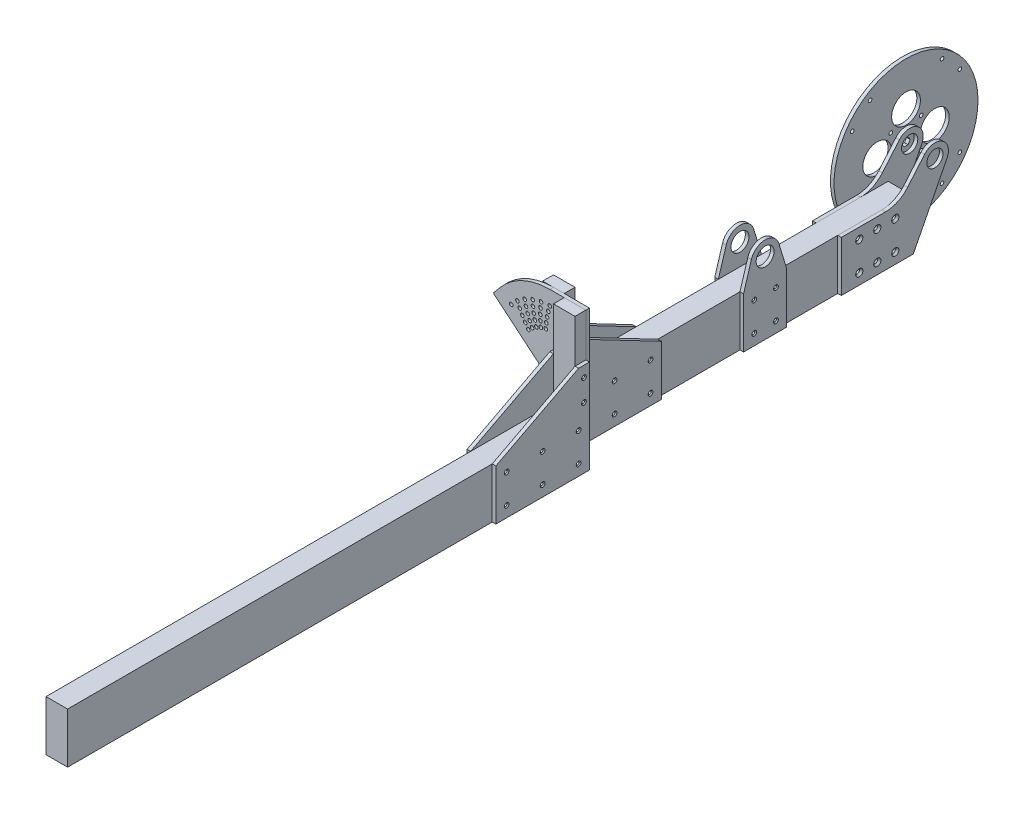
from build123d import *

# Parameters (mm, degrees)
SKETCH1_R                                   = 127
SKETCH1_R_2                                 = 25.4
BOSS_EXTRUDE1_DEPTH                         = 6.35
SKETCH3_R                                   = 3.175
CUT_EXTRUDE1_DEPTH                          = 6.35
SKETCH4_R                                   = 14.2875
BOSS_EXTRUDE2_DEPTH                         = 6.35
SKETCH5_R                                   = 3.175
CUT_EXTRUDE2_DEPTH                          = 6.35
CHAMFER1_SIZE                               = 3.175
SKETCH7_W                                   = 38.1
SKETCH7_H                                   = 88.9
BOSS_EXTRUDE3_DEPTH                         = 609.6
SKETCH8_W                                   = 38.1
SKETCH8_H                                   = 19.05
BOSS_EXTRUDE4_DEPTH                         = 152.4
BOSS_EXTRUDE5_DEPTH                         = 6.35
CSK_FOR_8_FLAT_HEAD_MACHINE_SCREW_2_COUNT   = 2
CSK_FOR_8_FLAT_HEAD_MACHINE_SCREW_2_PITCH   = 38.1
CSK_FOR_8_FLAT_HEAD_MACHINE_SCREW_3_COUNT   = 2
CSK_FOR_8_FLAT_HEAD_MACHINE_SCREW_3_PITCH   = 76.793005053
CSK_FOR_8_FLAT_HEAD_MACHINE_SCREW_4_COUNT   = 2
CSK_FOR_8_FLAT_HEAD_MACHINE_SCREW_4_PITCH   = 127.356686613
CSK_FOR_8_FLAT_HEAD_MACHINE_SCREW_5_COUNT   = 2
CSK_FOR_8_FLAT_HEAD_MACHINE_SCREW_5_PITCH   = 146.497954337
CSK_FOR_8_FLAT_HEAD_MACHINE_SCREW_6_COUNT   = 2
CSK_FOR_8_FLAT_HEAD_MACHINE_SCREW_6_PITCH   = 105.54189038
CSK_FOR_8_FLAT_HEAD_MACHINE_SCREW_7_COUNT   = 2
CSK_FOR_8_FLAT_HEAD_MACHINE_SCREW_7_PITCH   = 156.350617604
CSK_FOR_8_FLAT_HEAD_MACHINE_SCREW_8_COUNT   = 2
CSK_FOR_8_FLAT_HEAD_MACHINE_SCREW_8_PITCH   = 186.461995122
SKETCH13_R                                  = 3.175
CUT_EXTRUDE3_DEPTH                          = 19.05
SKETCH16_R                                  = 3.175
CUT_EXTRUDE5_DEPTH                          = 19.05
SKETCH14_R                                  = 3.175
BOSS_EXTRUDE6_DEPTH                         = 6.35
CSK_FOR_8_FLAT_HEAD_MACHINE_SCREW_9_A_COUNT = 2
CSK_FOR_8_FLAT_HEAD_MACHINE_SCREW_9_A_PITCH = 101.6
CSK_FOR_8_FLAT_HEAD_MACHINE_SCREW_10_COUNT  = 2
CSK_FOR_8_FLAT_HEAD_MACHINE_SCREW_10_PITCH  = 76.2
CSK_FOR_8_FLAT_HEAD_MACHINE_SCREW_11_COUNT  = 2
CSK_FOR_8_FLAT_HEAD_MACHINE_SCREW_11_PITCH  = 50.8
CSK_FOR_8_FLAT_HEAD_MACHINE_SCREW_12_COUNT  = 2
CSK_FOR_8_FLAT_HEAD_MACHINE_SCREW_12_PITCH  = 25.4
SKETCH21_W                                  = 38.1
SKETCH21_H                                  = 152.4
BOSS_EXTRUDE7_DEPTH                         = 19.05
SKETCH24_R                                  = 15.875
BOSS_EXTRUDE11_DEPTH                        = 6.35
CSK_FOR_8_FLAT_HEAD_MACHINE_SCREW_14_COUNT  = 2
CSK_FOR_8_FLAT_HEAD_MACHINE_SCREW_14_PITCH  = 50.8
CSK_FOR_8_FLAT_HEAD_MACHINE_SCREW_15_COUNT  = 2
CSK_FOR_8_FLAT_HEAD_MACHINE_SCREW_15_PITCH  = 63.5
CSK_FOR_8_FLAT_HEAD_MACHINE_SCREW_16_COUNT  = 2
CSK_FOR_8_FLAT_HEAD_MACHINE_SCREW_16_PITCH  = 38.1
BOSS_EXTRUDE12_DEPTH                        = 6.35
CSK_FOR_8_FLAT_HEAD_MACHINE_SCREW_18_COUNT  = 2
CSK_FOR_8_FLAT_HEAD_MACHINE_SCREW_18_PITCH  = 38.1
CSK_FOR_8_FLAT_HEAD_MACHINE_SCREW_19_COUNT  = 2
CSK_FOR_8_FLAT_HEAD_MACHINE_SCREW_19_PITCH  = 76.793005053
CSK_FOR_8_FLAT_HEAD_MACHINE_SCREW_20_COUNT  = 2
CSK_FOR_8_FLAT_HEAD_MACHINE_SCREW_20_PITCH  = 127.356686613
CSK_FOR_8_FLAT_HEAD_MACHINE_SCREW_21_COUNT  = 2
CSK_FOR_8_FLAT_HEAD_MACHINE_SCREW_21_PITCH  = 105.54189038
CSK_FOR_8_FLAT_HEAD_MACHINE_SCREW_22_COUNT  = 2
CSK_FOR_8_FLAT_HEAD_MACHINE_SCREW_22_PITCH  = 146.497954337
CSK_FOR_8_FLAT_HEAD_MACHINE_SCREW_23_COUNT  = 2
CSK_FOR_8_FLAT_HEAD_MACHINE_SCREW_23_PITCH  = 156.350617604
CSK_FOR_8_FLAT_HEAD_MACHINE_SCREW_24_COUNT  = 2
CSK_FOR_8_FLAT_HEAD_MACHINE_SCREW_24_PITCH  = 186.461995122
SKETCH33_W                                  = 38.1
SKETCH33_H                                  = 88.9
BOSS_EXTRUDE13_DEPTH                        = 914.4


with BuildPart() as part:
    # Sketch1 → Boss-Extrude1 (new body)
    with BuildSketch(Plane(origin=(0, 0, 0), x_dir=(0, 0, -1), z_dir=(1, 0, 0))):
        Circle(SKETCH1_R)
        with Locations((0, 50.8)):
            Circle(SKETCH1_R_2, mode=Mode.SUBTRACT)
        with Locations((50.8, 0)):
            Circle(SKETCH1_R_2, mode=Mode.SUBTRACT)
        with Locations((0, -50.8)):
            Circle(SKETCH1_R_2, mode=Mode.SUBTRACT)
        with Locations((-50.8, 0)):
            Circle(SKETCH1_R_2, mode=Mode.SUBTRACT)
        Polygon((7.18570145, 0), (3.592850725, 6.223), (-3.592850725, 6.223), (-7.18570145, 0), (-3.592850725, -6.223), (3.592850725, -6.223), align=None, mode=Mode.SUBTRACT)
    extrude(amount=BOSS_EXTRUDE1_DEPTH)

    # Sketch3 → Cut-Extrude1 (cut)
    with BuildSketch(Plane(origin=(6.35, 0, 0), x_dir=(0, 0, -1), z_dir=(1, 0, 0))):
        with Locations((-26.940768363, 26.940768363)):
            Circle(SKETCH3_R)
        with Locations((26.940768363, 26.940768363)):
            Circle(SKETCH3_R)
        with Locations((26.940768363, -26.940768363)):
            Circle(SKETCH3_R)
        with Locations((-26.940768363, -26.940768363)):
            Circle(SKETCH3_R)
        with Locations((-63.5, 95.038097624)):
            Circle(SKETCH3_R)
        with Locations((63.5, 95.038097624)):
            Circle(SKETCH3_R)
        with Locations((95.038097624, 63.5)):
            Circle(SKETCH3_R)
        with Locations((95.038097624, -63.5)):
            Circle(SKETCH3_R)
        with Locations((63.5, -95.038097624)):
            Circle(SKETCH3_R)
        with Locations((-63.5, -95.038097624)):
            Circle(SKETCH3_R)
        with Locations((-95.038097624, -63.5)):
            Circle(SKETCH3_R)
        with Locations((-95.038097624, 63.5)):
            Circle(SKETCH3_R)
    extrude(amount=-CUT_EXTRUDE1_DEPTH, mode=Mode.SUBTRACT)


with BuildPart() as body_2:
    # Sketch4 → Boss-Extrude2 (new body)
    with BuildSketch(Plane(origin=(6.477, 0, 0), x_dir=(0, 0, -1), z_dir=(1, 0, 0))):
        with BuildLine():
            Line((-38.1, -127), (-165.1, -127))
            Line((-165.1, -127), (-165.1, -38.1))
            Line((-165.1, -38.1), (-87.038042562, -38.1))
            ThreePointArc((-87.038042562, -38.1), (-65.681178278, -33.392562827), (-48.282428043, -20.142690865))
            Line((-48.282428043, -20.142690865), (-18.166694306, 15.395011343))
            ThreePointArc((-18.166694306, 15.395011343), (13.199129751, 19.819640008), (21.208545562, -10.827407419))
            Line((21.208545562, -10.827407419), (-38.1, -127))
        make_face()
        Circle(SKETCH4_R, mode=Mode.SUBTRACT)
    extrude(amount=BOSS_EXTRUDE2_DEPTH)

    # Sketch5 → Cut-Extrude2 (cut)
    with BuildSketch(Plane(origin=(12.827, 0, 0), x_dir=(0, 0, -1), z_dir=(1, 0, 0))):
        with Locations((-133.35, -57.15)):
            Circle(SKETCH5_R)
        with Locations((-101.6, -57.15)):
            Circle(SKETCH5_R)
        with Locations((-69.85, -57.15)):
            Circle(SKETCH5_R)
        with Locations((-133.35, -107.95)):
            Circle(SKETCH5_R)
        with Locations((-101.6, -107.95)):
            Circle(SKETCH5_R)
        with Locations((-69.85, -107.95)):
            Circle(SKETCH5_R)
    extrude(amount=-CUT_EXTRUDE2_DEPTH, mode=Mode.SUBTRACT)

    # Chamfer1
    chamfer1_edges = [body_2.edges().sort_by_distance(p)[0] for p in [
        (6.477, -57.15, 104.775),
        (6.477, -57.15, 73.025),
        (6.477, -107.95, 136.525),
        (6.477, -107.95, 104.775),
        (6.477, -107.95, 73.025),
        (6.477, -57.15, 136.525),
    ]]
    chamfer(chamfer1_edges, length=CHAMFER1_SIZE)


with BuildPart() as body_3:
    # Sketch7 → Boss-Extrude3 (new body)
    with BuildSketch(Plane.XY.offset(38.1)):
        with Locations((31.877, -82.55)):
            Rectangle(SKETCH7_W, SKETCH7_H)
    extrude(amount=BOSS_EXTRUDE3_DEPTH)


with BuildPart() as body_4:
    # Mirror1: mirrored copy
    add(body_2.part.mirror(Plane(origin=(31.877, 0, 0), x_dir=(0, 0, 1), z_dir=(1, 0, 0))))


with BuildPart() as body_5:
    # Sketch8 → Boss-Extrude4 (new body)
    with BuildSketch(Plane(origin=(0, -38.1, 0), x_dir=(1, 0, 0), z_dir=(0, 1, 0))):
        with Locations((31.877, -638.175)):
            Rectangle(SKETCH8_W, SKETCH8_H)
    extrude(amount=BOSS_EXTRUDE4_DEPTH)


with BuildPart() as body_6:
    # Sketch9 → Boss-Extrude5 (new body)
    with BuildSketch(Plane.ZY.offset(-12.827)):
        Polygon((647.7, 38.1), (647.7, -127), (482.6, -127), (482.6, -38.1), (628.65, 38.1), align=None)
    extrude(amount=BOSS_EXTRUDE5_DEPTH)


with BuildPart() as csk_for_8_flat_head_machine_screw_100_tool:
    # Sketch11 → CSK for _8 Flat Head Machine Screw _100 (revolve)
    with BuildSketch(Plane(origin=(6.477, 19.05, 638.175), x_dir=(0, 0, 1), z_dir=(0, 1, 0))):
        Polygon((0, 0), (0, 8.945274586), (2.2479, 7.5946), (2.2479, 1.651767624), (4.2164, 0), align=None)
    csk_for_8_flat_head_machine_screw_100 = revolve(axis=Axis((0.127, 19.05, 638.175), (1, 0, 0)))


with BuildPart() as body_5_1:
    add(body_5.part)

    # CSK for _8 Flat Head Machine Screw _100: cut by csk_for_8_flat_head_machine_screw_100_tool
    add(csk_for_8_flat_head_machine_screw_100_tool.part, mode=Mode.SUBTRACT)


with BuildPart() as body_6_1:
    add(body_6.part)

    # CSK for _8 Flat Head Machine Screw _100: cut by csk_for_8_flat_head_machine_screw_100_tool
    add(csk_for_8_flat_head_machine_screw_100_tool.part, mode=Mode.SUBTRACT)


with BuildPart() as csk_for_8_flat_head_machine_screw_2_tool:
    # CSK for _8 Flat Head Machine Screw _ 2: CSK for _8 Flat Head Machine Screw _100 ×2
    with Locations(*[(0, -i * CSK_FOR_8_FLAT_HEAD_MACHINE_SCREW_2_PITCH, 0) for i in range(1, CSK_FOR_8_FLAT_HEAD_MACHINE_SCREW_2_COUNT)]):
        add(csk_for_8_flat_head_machine_screw_100)


with BuildPart() as body_5_2:
    add(body_5_1.part)

    # CSK for _8 Flat Head Machine Screw _ 2: cut by csk_for_8_flat_head_machine_screw_2_tool
    add(csk_for_8_flat_head_machine_screw_2_tool.part, mode=Mode.SUBTRACT)

    # Sketch13 → Cut-Extrude3 (cut)
    with BuildSketch(Plane.XY.offset(647.7)):
        with Locations((31.877, 0)):
            Circle(SKETCH13_R)
        with Locations((31.877, 88.9)):
            Circle(SKETCH13_R)
    extrude(amount=-CUT_EXTRUDE3_DEPTH, mode=Mode.SUBTRACT)

    # Sketch16 → Cut-Extrude5 (cut)
    with BuildSketch(Plane.XY.offset(647.7)):
        with Locations((31.877, 79.375)):
            Circle(SKETCH16_R)
        with Locations((31.877, 69.85)):
            Circle(SKETCH16_R)
        with Locations((31.877, 60.325)):
            Circle(SKETCH16_R)
        with Locations((31.877, 50.8)):
            Circle(SKETCH16_R)
    extrude(amount=-CUT_EXTRUDE5_DEPTH, mode=Mode.SUBTRACT)


with BuildPart() as body_6_2:
    add(body_6_1.part)

    # CSK for _8 Flat Head Machine Screw _ 2: cut by csk_for_8_flat_head_machine_screw_2_tool
    add(csk_for_8_flat_head_machine_screw_2_tool.part, mode=Mode.SUBTRACT)


with BuildPart() as csk_for_8_flat_head_machine_screw_3_tool:
    # CSK for _8 Flat Head Machine Screw _ 3: CSK for _8 Flat Head Machine Screw _100 ×2
    with Locations(*[Vector(0, -0.9922778767136677, -0.12403473458920822) * (i * CSK_FOR_8_FLAT_HEAD_MACHINE_SCREW_3_PITCH) for i in range(1, CSK_FOR_8_FLAT_HEAD_MACHINE_SCREW_3_COUNT)]):
        add(csk_for_8_flat_head_machine_screw_100)


with BuildPart() as body_3_1:
    add(body_3.part)

    # CSK for _8 Flat Head Machine Screw _ 3: cut by csk_for_8_flat_head_machine_screw_3_tool
    add(csk_for_8_flat_head_machine_screw_3_tool.part, mode=Mode.SUBTRACT)


with BuildPart() as body_6_3:
    add(body_6_2.part)

    # CSK for _8 Flat Head Machine Screw _ 3: cut by csk_for_8_flat_head_machine_screw_3_tool
    add(csk_for_8_flat_head_machine_screw_3_tool.part, mode=Mode.SUBTRACT)


with BuildPart() as csk_for_8_flat_head_machine_screw_4_tool:
    # CSK for _8 Flat Head Machine Screw _ 4: CSK for _8 Flat Head Machine Screw _100 ×2
    with Locations(*[Vector(0, -0.9971993098884565, -0.07478994824163403) * (i * CSK_FOR_8_FLAT_HEAD_MACHINE_SCREW_4_PITCH) for i in range(1, CSK_FOR_8_FLAT_HEAD_MACHINE_SCREW_4_COUNT)]):
        add(csk_for_8_flat_head_machine_screw_100)


with BuildPart() as body_3_2:
    add(body_3_1.part)

    # CSK for _8 Flat Head Machine Screw _ 4: cut by csk_for_8_flat_head_machine_screw_4_tool
    add(csk_for_8_flat_head_machine_screw_4_tool.part, mode=Mode.SUBTRACT)


with BuildPart() as body_6_4:
    add(body_6_3.part)

    # CSK for _8 Flat Head Machine Screw _ 4: cut by csk_for_8_flat_head_machine_screw_4_tool
    add(csk_for_8_flat_head_machine_screw_4_tool.part, mode=Mode.SUBTRACT)


with BuildPart() as csk_for_8_flat_head_machine_screw_5_tool:
    # CSK for _8 Flat Head Machine Screw _ 5: CSK for _8 Flat Head Machine Screw _100 ×2
    with Locations(*[Vector(0, -0.8669063030575354, -0.4984711242580825) * (i * CSK_FOR_8_FLAT_HEAD_MACHINE_SCREW_5_PITCH) for i in range(1, CSK_FOR_8_FLAT_HEAD_MACHINE_SCREW_5_COUNT)]):
        add(csk_for_8_flat_head_machine_screw_100)


with BuildPart() as body_3_3:
    add(body_3_2.part)

    # CSK for _8 Flat Head Machine Screw _ 5: cut by csk_for_8_flat_head_machine_screw_5_tool
    add(csk_for_8_flat_head_machine_screw_5_tool.part, mode=Mode.SUBTRACT)


with BuildPart() as body_6_5:
    add(body_6_4.part)

    # CSK for _8 Flat Head Machine Screw _ 5: cut by csk_for_8_flat_head_machine_screw_5_tool
    add(csk_for_8_flat_head_machine_screw_5_tool.part, mode=Mode.SUBTRACT)


with BuildPart() as csk_for_8_flat_head_machine_screw_6_tool:
    # CSK for _8 Flat Head Machine Screw _ 6: CSK for _8 Flat Head Machine Screw _100 ×2
    with Locations(*[Vector(0, -0.7219882051154243, -0.6919053632356149) * (i * CSK_FOR_8_FLAT_HEAD_MACHINE_SCREW_6_PITCH) for i in range(1, CSK_FOR_8_FLAT_HEAD_MACHINE_SCREW_6_COUNT)]):
        add(csk_for_8_flat_head_machine_screw_100)


with BuildPart() as body_3_4:
    add(body_3_3.part)

    # CSK for _8 Flat Head Machine Screw _ 6: cut by csk_for_8_flat_head_machine_screw_6_tool
    add(csk_for_8_flat_head_machine_screw_6_tool.part, mode=Mode.SUBTRACT)


with BuildPart() as body_6_6:
    add(body_6_5.part)

    # CSK for _8 Flat Head Machine Screw _ 6: cut by csk_for_8_flat_head_machine_screw_6_tool
    add(csk_for_8_flat_head_machine_screw_6_tool.part, mode=Mode.SUBTRACT)


with BuildPart() as csk_for_8_flat_head_machine_screw_7_tool:
    # CSK for _8 Flat Head Machine Screw _ 7: CSK for _8 Flat Head Machine Screw _100 ×2
    with Locations(*[Vector(0, -0.4873661592641371, -0.8731977020149125) * (i * CSK_FOR_8_FLAT_HEAD_MACHINE_SCREW_7_PITCH) for i in range(1, CSK_FOR_8_FLAT_HEAD_MACHINE_SCREW_7_COUNT)]):
        add(csk_for_8_flat_head_machine_screw_100)


with BuildPart() as body_3_5:
    add(body_3_4.part)

    # CSK for _8 Flat Head Machine Screw _ 7: cut by csk_for_8_flat_head_machine_screw_7_tool
    add(csk_for_8_flat_head_machine_screw_7_tool.part, mode=Mode.SUBTRACT)


with BuildPart() as body_6_7:
    add(body_6_6.part)

    # CSK for _8 Flat Head Machine Screw _ 7: cut by csk_for_8_flat_head_machine_screw_7_tool
    add(csk_for_8_flat_head_machine_screw_7_tool.part, mode=Mode.SUBTRACT)


with BuildPart() as csk_for_8_flat_head_machine_screw_8_tool:
    # CSK for _8 Flat Head Machine Screw _ 8: CSK for _8 Flat Head Machine Screw _100 ×2
    with Locations(*[Vector(0, -0.6811039424772873, -0.7321867381630838) * (i * CSK_FOR_8_FLAT_HEAD_MACHINE_SCREW_8_PITCH) for i in range(1, CSK_FOR_8_FLAT_HEAD_MACHINE_SCREW_8_COUNT)]):
        add(csk_for_8_flat_head_machine_screw_100)


with BuildPart() as body_3_6:
    add(body_3_5.part)

    # CSK for _8 Flat Head Machine Screw _ 8: cut by csk_for_8_flat_head_machine_screw_8_tool
    add(csk_for_8_flat_head_machine_screw_8_tool.part, mode=Mode.SUBTRACT)


with BuildPart() as body_6_8:
    add(body_6_7.part)

    # CSK for _8 Flat Head Machine Screw _ 8: cut by csk_for_8_flat_head_machine_screw_8_tool
    add(csk_for_8_flat_head_machine_screw_8_tool.part, mode=Mode.SUBTRACT)


with BuildPart() as body_7:
    # Mirror2: mirrored copy
    add(body_6_8.part.mirror(Plane(origin=(31.877, 0, 0), x_dir=(0, 0, 1), z_dir=(1, 0, 0))))


with BuildPart() as body_8:
    # Sketch14 → Boss-Extrude6 (new body)
    with BuildSketch(Plane.XY.offset(647.7)):
        with BuildLine():
            Line((57.277, -38.1), (12.827, -38.1))
            Line((12.827, -38.1), (12.827, -8.883160888))
            Line((12.827, -8.883160888), (-67.926983813, 58.877477146))
            Line((-67.926983813, 58.877477146), (-55.681879848, 73.470623787))
            ThreePointArc((-55.681879848, 73.470623787), (-16.428267317, 103.590980058), (31.877, 114.3))
            Line((31.877, 114.3), (50.927, 114.3))
            Line((50.927, 114.3), (95.377, 114.3))
            Line((95.377, 114.3), (95.377, -38.1))
            Line((95.377, -38.1), (57.277, -38.1))
        make_face()
        with Locations((31.877, 88.9)):
            Circle(SKETCH14_R, mode=Mode.SUBTRACT)
        with Locations((29.106852449, 79.326646895)):
            Circle(SKETCH14_R, mode=Mode.SUBTRACT)
        with Locations((15.374009541, 77.640465808)):
            Circle(SKETCH14_R, mode=Mode.SUBTRACT)
        with Locations((2.142601648, 73.595218456)):
            Circle(SKETCH14_R, mode=Mode.SUBTRACT)
        with Locations((-10.185341599, 67.313817632)):
            Circle(SKETCH14_R, mode=Mode.SUBTRACT)
        with Locations((-21.23524188, 58.987120522)):
            Circle(SKETCH14_R, mode=Mode.SUBTRACT)
        with Locations((27.004510309, 69.679848911)):
            Circle(SKETCH14_R, mode=Mode.SUBTRACT)
        with Locations((25.571320453, 59.994533338)):
            Circle(SKETCH14_R, mode=Mode.SUBTRACT)
        with Locations((24.807006471, 50.305617892)):
            Circle(SKETCH14_R, mode=Mode.SUBTRACT)
        with Locations((14.978755592, 67.77515648)):
            Circle(SKETCH14_R, mode=Mode.SUBTRACT)
        with Locations((3.466445481, 63.811150216)):
            Circle(SKETCH14_R, mode=Mode.SUBTRACT)
        with Locations((-7.182624307, 57.908274443)):
            Circle(SKETCH14_R, mode=Mode.SUBTRACT)
        with Locations((-16.644887177, 50.245885054)):
            Circle(SKETCH14_R, mode=Mode.SUBTRACT)
        with Locations((15.24917651, 57.988111807)):
            Circle(SKETCH14_R, mode=Mode.SUBTRACT)
        with Locations((5.43226057, 54.219750843)):
            Circle(SKETCH14_R, mode=Mode.SUBTRACT)
        with Locations((-3.581145345, 48.803950186)):
            Circle(SKETCH14_R, mode=Mode.SUBTRACT)
        with Locations((-11.517173455, 41.905266198)):
            Circle(SKETCH14_R, mode=Mode.SUBTRACT)
        with Locations((16.178936686, 48.313671028)):
            Circle(SKETCH14_R, mode=Mode.SUBTRACT)
        with Locations((8.02784461, 44.853737717)):
            Circle(SKETCH14_R, mode=Mode.SUBTRACT)
        with Locations((0.601397053, 40.030946283)):
            Circle(SKETCH14_R, mode=Mode.SUBTRACT)
        with Locations((-5.874757134, 33.991834803)):
            Circle(SKETCH14_R, mode=Mode.SUBTRACT)
        with Locations((16.439677005, 87.549409243)):
            Circle(SKETCH14_R, mode=Mode.SUBTRACT)
        with Locations((1.471409258, 83.538673988)):
            Circle(SKETCH14_R, mode=Mode.SUBTRACT)
        with Locations((-12.573, 76.989658396)):
            Circle(SKETCH14_R, mode=Mode.SUBTRACT)
        with Locations((-25.266818501, 68.101350993)):
            Circle(SKETCH14_R, mode=Mode.SUBTRACT)
        with Locations((-36.224350993, 57.143818501)):
            Circle(SKETCH14_R, mode=Mode.SUBTRACT)
        with Locations((31.877, 0)):
            Circle(SKETCH14_R, mode=Mode.SUBTRACT)
    extrude(amount=BOSS_EXTRUDE6_DEPTH)

    # Sketch20 → CSK for _8 Flat Head Machine Screw _ 9 (revolve, cut)
    with BuildSketch(Plane(origin=(76.327, 88.9, 647.7), x_dir=(0, 1, 0), z_dir=(1, 0, 0))):
        Polygon((0, 0), (0, 7.700674586), (2.2479, 6.35), (2.2479, 1.651767624), (4.2164, 0), align=None)
    csk_for_8_flat_head_machine_screw_9 = revolve(axis=Axis((76.327, 88.9, 641.35), (0, 0, 1)), mode=Mode.SUBTRACT)

    # CSK for _8 Flat Head Machine Screw _ 9 a: CSK for _8 Flat Head Machine Screw _ 9 ×2
    with Locations(*[(0, -i * CSK_FOR_8_FLAT_HEAD_MACHINE_SCREW_9_A_PITCH, 0) for i in range(1, CSK_FOR_8_FLAT_HEAD_MACHINE_SCREW_9_A_COUNT)]):
        add(csk_for_8_flat_head_machine_screw_9, mode=Mode.SUBTRACT)

    # CSK for _8 Flat Head Machine Screw _ 10: CSK for _8 Flat Head Machine Screw _ 9 ×2
    with Locations(*[(0, -i * CSK_FOR_8_FLAT_HEAD_MACHINE_SCREW_10_PITCH, 0) for i in range(1, CSK_FOR_8_FLAT_HEAD_MACHINE_SCREW_10_COUNT)]):
        add(csk_for_8_flat_head_machine_screw_9, mode=Mode.SUBTRACT)

    # CSK for _8 Flat Head Machine Screw _ 11: CSK for _8 Flat Head Machine Screw _ 9 ×2
    with Locations(*[(0, -i * CSK_FOR_8_FLAT_HEAD_MACHINE_SCREW_11_PITCH, 0) for i in range(1, CSK_FOR_8_FLAT_HEAD_MACHINE_SCREW_11_COUNT)]):
        add(csk_for_8_flat_head_machine_screw_9, mode=Mode.SUBTRACT)

    # CSK for _8 Flat Head Machine Screw _ 12: CSK for _8 Flat Head Machine Screw _ 9 ×2
    with Locations(*[(0, -i * CSK_FOR_8_FLAT_HEAD_MACHINE_SCREW_12_PITCH, 0) for i in range(1, CSK_FOR_8_FLAT_HEAD_MACHINE_SCREW_12_COUNT)]):
        add(csk_for_8_flat_head_machine_screw_9, mode=Mode.SUBTRACT)


with BuildPart() as body_9:
    # Sketch21 → Boss-Extrude7 (new body)
    with BuildSketch(Plane.XY.offset(654.05)):
        with Locations((76.327, 38.1)):
            Rectangle(SKETCH21_W, SKETCH21_H)
    extrude(amount=BOSS_EXTRUDE7_DEPTH)


with BuildPart() as body_10:
    # Sketch24 → Boss-Extrude11 (new body)
    with BuildSketch(Plane(origin=(50.927, 0, 0), x_dir=(0, 0, -1), z_dir=(1, 0, 0))):
        with BuildLine():
            Line((-337.598503606, -127), (-261.398503606, -127))
            Line((-261.398503606, -127), (-261.398503606, -38.1))
            Line((-261.398503606, -38.1), (-275.192154002, 7.373016271))
            ThreePointArc((-275.192154002, 7.373016271), (-299.498503606, 25.4), (-323.80485321, 7.373016271))
            Line((-323.80485321, 7.373016271), (-337.598503606, -38.1))
            Line((-337.598503606, -38.1), (-337.598503606, -127))
        make_face()
        with Locations((-299.498503606, 0)):
            Circle(SKETCH24_R, mode=Mode.SUBTRACT)
    extrude(amount=BOSS_EXTRUDE11_DEPTH)


with BuildPart() as csk_for_8_flat_head_machine_screw_13_tool:
    # Sketch26 → CSK for _8 Flat Head Machine Screw _ 13 (revolve)
    with BuildSketch(Plane(origin=(57.277, -57.15, 280.448503606), x_dir=(0, 0, -1), z_dir=(0, 1, 0))):
        Polygon((0, 0), (0, 7.700674586), (2.2479, 6.35), (2.2479, 1.651767624), (4.2164, 0), align=None)
    csk_for_8_flat_head_machine_screw_13 = revolve(axis=Axis((63.627, -57.15, 280.448503606), (-1, 0, 0)))


with BuildPart() as body_3_7:
    add(body_3_6.part)

    # CSK for _8 Flat Head Machine Screw _ 13: cut by csk_for_8_flat_head_machine_screw_13_tool
    add(csk_for_8_flat_head_machine_screw_13_tool.part, mode=Mode.SUBTRACT)


with BuildPart() as body_10_1:
    add(body_10.part)

    # CSK for _8 Flat Head Machine Screw _ 13: cut by csk_for_8_flat_head_machine_screw_13_tool
    add(csk_for_8_flat_head_machine_screw_13_tool.part, mode=Mode.SUBTRACT)


with BuildPart() as csk_for_8_flat_head_machine_screw_14_tool:
    # CSK for _8 Flat Head Machine Screw _ 14: CSK for _8 Flat Head Machine Screw _ 13 ×2
    with Locations(*[(0, -i * CSK_FOR_8_FLAT_HEAD_MACHINE_SCREW_14_PITCH, 0) for i in range(1, CSK_FOR_8_FLAT_HEAD_MACHINE_SCREW_14_COUNT)]):
        add(csk_for_8_flat_head_machine_screw_13)


with BuildPart() as body_3_8:
    add(body_3_7.part)

    # CSK for _8 Flat Head Machine Screw _ 14: cut by csk_for_8_flat_head_machine_screw_14_tool
    add(csk_for_8_flat_head_machine_screw_14_tool.part, mode=Mode.SUBTRACT)


with BuildPart() as body_10_2:
    add(body_10_1.part)

    # CSK for _8 Flat Head Machine Screw _ 14: cut by csk_for_8_flat_head_machine_screw_14_tool
    add(csk_for_8_flat_head_machine_screw_14_tool.part, mode=Mode.SUBTRACT)


with BuildPart() as csk_for_8_flat_head_machine_screw_15_tool:
    # CSK for _8 Flat Head Machine Screw _ 15: CSK for _8 Flat Head Machine Screw _ 13 ×2
    with Locations(*[Vector(0, -0.7999999999999999, 0.6000000000000002) * (i * CSK_FOR_8_FLAT_HEAD_MACHINE_SCREW_15_PITCH) for i in range(1, CSK_FOR_8_FLAT_HEAD_MACHINE_SCREW_15_COUNT)]):
        add(csk_for_8_flat_head_machine_screw_13)


with BuildPart() as body_3_9:
    add(body_3_8.part)

    # CSK for _8 Flat Head Machine Screw _ 15: cut by csk_for_8_flat_head_machine_screw_15_tool
    add(csk_for_8_flat_head_machine_screw_15_tool.part, mode=Mode.SUBTRACT)


with BuildPart() as body_10_3:
    add(body_10_2.part)

    # CSK for _8 Flat Head Machine Screw _ 15: cut by csk_for_8_flat_head_machine_screw_15_tool
    add(csk_for_8_flat_head_machine_screw_15_tool.part, mode=Mode.SUBTRACT)


with BuildPart() as csk_for_8_flat_head_machine_screw_16_tool:
    # CSK for _8 Flat Head Machine Screw _ 16: CSK for _8 Flat Head Machine Screw _ 13 ×2
    with Locations(*[(0, 0, i * CSK_FOR_8_FLAT_HEAD_MACHINE_SCREW_16_PITCH) for i in range(1, CSK_FOR_8_FLAT_HEAD_MACHINE_SCREW_16_COUNT)]):
        add(csk_for_8_flat_head_machine_screw_13)


with BuildPart() as body_3_10:
    add(body_3_9.part)

    # CSK for _8 Flat Head Machine Screw _ 16: cut by csk_for_8_flat_head_machine_screw_16_tool
    add(csk_for_8_flat_head_machine_screw_16_tool.part, mode=Mode.SUBTRACT)


with BuildPart() as body_10_4:
    add(body_10_3.part)

    # CSK for _8 Flat Head Machine Screw _ 16: cut by csk_for_8_flat_head_machine_screw_16_tool
    add(csk_for_8_flat_head_machine_screw_16_tool.part, mode=Mode.SUBTRACT)


with BuildPart() as body_11:
    # Mirror4: mirrored copy
    add(body_10_4.part.mirror(Plane(origin=(31.877, 0, 0), x_dir=(0, 0, 1), z_dir=(1, 0, 0))))


with BuildPart() as body_12:
    # Sketch27 → Boss-Extrude12 (new body)
    with BuildSketch(Plane.ZY.offset(-57.277)):
        Polygon((654.05, 38.1), (654.05, -127), (819.15, -127), (819.15, -38.1), (673.1, 38.1), align=None)
    extrude(amount=BOSS_EXTRUDE12_DEPTH)


with BuildPart() as csk_for_8_flat_head_machine_screw_17_tool:
    # Sketch30 → CSK for _8 Flat Head Machine Screw _ 17 (revolve)
    with BuildSketch(Plane(origin=(50.927, 19.05, 663.575), x_dir=(0, 0, 1), z_dir=(0, 1, 0))):
        Polygon((0, 0), (0, 7.700674586), (2.2479, 6.35), (2.2479, 1.651767624), (4.2164, 0), align=None)
    csk_for_8_flat_head_machine_screw_17 = revolve(axis=Axis((44.577, 19.05, 663.575), (1, 0, 0)))


with BuildPart() as body_9_1:
    add(body_9.part)

    # CSK for _8 Flat Head Machine Screw _ 17: cut by csk_for_8_flat_head_machine_screw_17_tool
    add(csk_for_8_flat_head_machine_screw_17_tool.part, mode=Mode.SUBTRACT)


with BuildPart() as body_12_1:
    add(body_12.part)

    # CSK for _8 Flat Head Machine Screw _ 17: cut by csk_for_8_flat_head_machine_screw_17_tool
    add(csk_for_8_flat_head_machine_screw_17_tool.part, mode=Mode.SUBTRACT)


with BuildPart() as csk_for_8_flat_head_machine_screw_18_tool:
    # CSK for _8 Flat Head Machine Screw _ 18: CSK for _8 Flat Head Machine Screw _ 17 ×2
    with Locations(*[(0, -i * CSK_FOR_8_FLAT_HEAD_MACHINE_SCREW_18_PITCH, 0) for i in range(1, CSK_FOR_8_FLAT_HEAD_MACHINE_SCREW_18_COUNT)]):
        add(csk_for_8_flat_head_machine_screw_17)


with BuildPart() as body_9_2:
    add(body_9_1.part)

    # CSK for _8 Flat Head Machine Screw _ 18: cut by csk_for_8_flat_head_machine_screw_18_tool
    add(csk_for_8_flat_head_machine_screw_18_tool.part, mode=Mode.SUBTRACT)


with BuildPart() as body_12_2:
    add(body_12_1.part)

    # CSK for _8 Flat Head Machine Screw _ 18: cut by csk_for_8_flat_head_machine_screw_18_tool
    add(csk_for_8_flat_head_machine_screw_18_tool.part, mode=Mode.SUBTRACT)

    # CSK for _8 Flat Head Machine Screw _ 19: CSK for _8 Flat Head Machine Screw _ 17 ×2
    with Locations(*[Vector(0, -0.9922778767136679, 0.12403473458920818) * (i * CSK_FOR_8_FLAT_HEAD_MACHINE_SCREW_19_PITCH) for i in range(1, CSK_FOR_8_FLAT_HEAD_MACHINE_SCREW_19_COUNT)]):
        add(csk_for_8_flat_head_machine_screw_17, mode=Mode.SUBTRACT)

    # CSK for _8 Flat Head Machine Screw _ 20: CSK for _8 Flat Head Machine Screw _ 17 ×2
    with Locations(*[Vector(0, -0.9971993098884565, 0.07478994824163407) * (i * CSK_FOR_8_FLAT_HEAD_MACHINE_SCREW_20_PITCH) for i in range(1, CSK_FOR_8_FLAT_HEAD_MACHINE_SCREW_20_COUNT)]):
        add(csk_for_8_flat_head_machine_screw_17, mode=Mode.SUBTRACT)

    # CSK for _8 Flat Head Machine Screw _ 21: CSK for _8 Flat Head Machine Screw _ 17 ×2
    with Locations(*[Vector(0, -0.7219882051154244, 0.6919053632356148) * (i * CSK_FOR_8_FLAT_HEAD_MACHINE_SCREW_21_PITCH) for i in range(1, CSK_FOR_8_FLAT_HEAD_MACHINE_SCREW_21_COUNT)]):
        add(csk_for_8_flat_head_machine_screw_17, mode=Mode.SUBTRACT)

    # CSK for _8 Flat Head Machine Screw _ 22: CSK for _8 Flat Head Machine Screw _ 17 ×2
    with Locations(*[Vector(0, -0.8669063030575352, 0.49847112425808265) * (i * CSK_FOR_8_FLAT_HEAD_MACHINE_SCREW_22_PITCH) for i in range(1, CSK_FOR_8_FLAT_HEAD_MACHINE_SCREW_22_COUNT)]):
        add(csk_for_8_flat_head_machine_screw_17, mode=Mode.SUBTRACT)

    # CSK for _8 Flat Head Machine Screw _ 23: CSK for _8 Flat Head Machine Screw _ 17 ×2
    with Locations(*[Vector(0, -0.48736615926413723, 0.8731977020149123) * (i * CSK_FOR_8_FLAT_HEAD_MACHINE_SCREW_23_PITCH) for i in range(1, CSK_FOR_8_FLAT_HEAD_MACHINE_SCREW_23_COUNT)]):
        add(csk_for_8_flat_head_machine_screw_17, mode=Mode.SUBTRACT)

    # CSK for _8 Flat Head Machine Screw _ 24: CSK for _8 Flat Head Machine Screw _ 17 ×2
    with Locations(*[Vector(0, -0.6811039424772873, 0.7321867381630838) * (i * CSK_FOR_8_FLAT_HEAD_MACHINE_SCREW_24_PITCH) for i in range(1, CSK_FOR_8_FLAT_HEAD_MACHINE_SCREW_24_COUNT)]):
        add(csk_for_8_flat_head_machine_screw_17, mode=Mode.SUBTRACT)


with BuildPart() as body_13:
    # Sketch33 → Boss-Extrude13 (new body)
    with BuildSketch(Plane.XY.offset(654.05)):
        with Locations((76.327, -82.55)):
            Rectangle(SKETCH33_W, SKETCH33_H)
    extrude(amount=BOSS_EXTRUDE13_DEPTH)


with BuildPart() as body_14:
    # Mirror5: mirrored copy
    add(body_12_2.part.mirror(Plane(origin=(76.327, 0, 0), x_dir=(0, 0, 1), z_dir=(1, 0, 0))))


solid = Compound([part.part, body_2.part, body_4.part, body_5_2.part, body_6_8.part, body_7.part, body_8.part, body_3_10.part, body_10_4.part, body_11.part, body_9_2.part, body_12_2.part, body_13.part, body_14.part])
